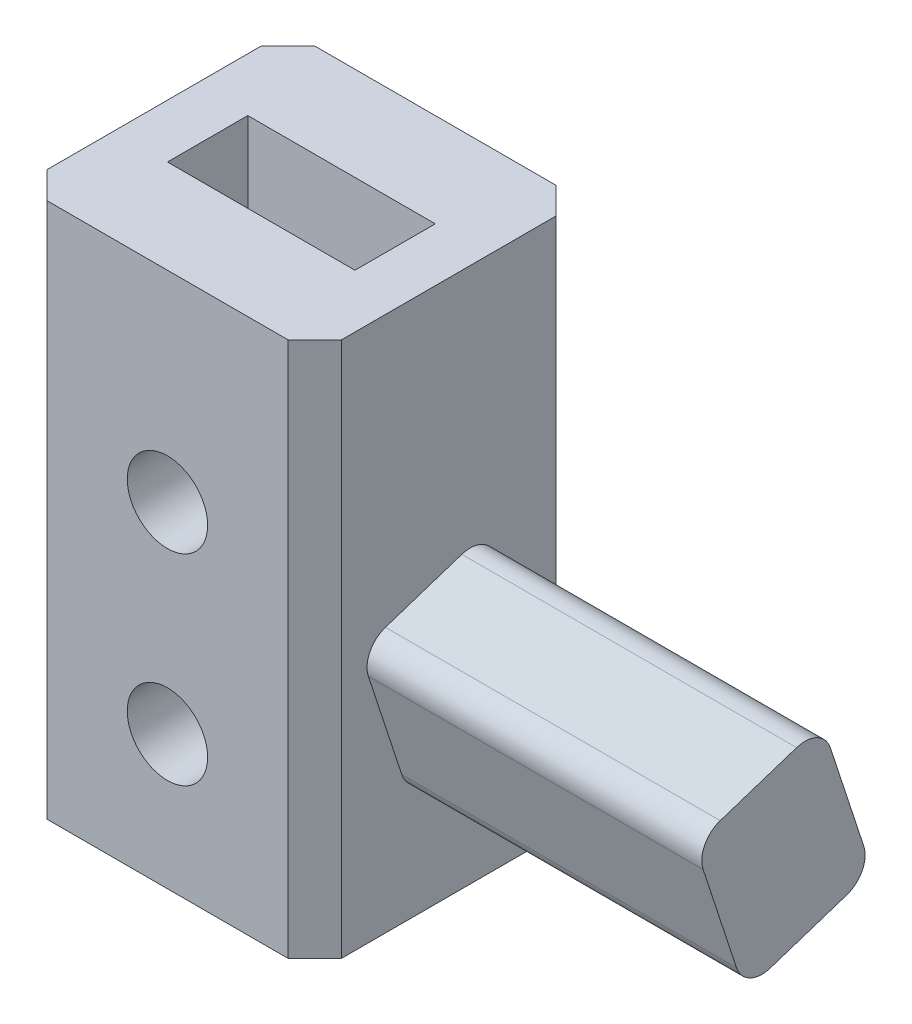
from build123d import *

# Parameters (mm, degrees)
CROQUIS1_W              = 14
CROQUIS1_H              = 6
SALIENTE_EXTRUIR1_DEPTH = 40
SALIENTE_EXTRUIR4_DEPTH = 25
CORTAR_EXTRUIR1_REACH   = 59.411
CROQUIS3_R              = 3


with BuildPart() as part:
    # Croquis1 → Saliente-Extruir1 (new body)
    with BuildSketch(Plane(origin=(0, 0, 0), x_dir=(1, 0, 0), z_dir=(0, 1, 0))):
        Polygon((-11, 8), (-9, 10), (9, 10), (11, 8), (11, -8), (9, -10), (-9, -10), (-11, -8), align=None)
        Rectangle(CROQUIS1_W, CROQUIS1_H, mode=Mode.SUBTRACT)
    extrude(amount=SALIENTE_EXTRUIR1_DEPTH)

    # Croquis2 → Saliente-Extruir4 (add)
    with BuildSketch(Plane(origin=(11, 0, 0), x_dir=(0, 0, -1), z_dir=(1, 0, 0))):
        with BuildLine():
            Line((-3.505117141, 9.641441068), (-5.99727833, 17.243357445))
            ThreePointArc((-5.99727833, 17.243357445), (-5.88119691, 18.769683379), (-4.719839533, 19.766876837))
            Line((-4.719839533, 19.766876837), (0.98159775, 21.635997729))
            ThreePointArc((0.98159775, 21.635997729), (2.507923683, 21.519916309), (3.505117141, 20.358558932))
            Line((3.505117141, 20.358558932), (5.99727833, 12.756642555))
            ThreePointArc((5.99727833, 12.756642555), (5.88119691, 11.230316621), (4.719839533, 10.233123163))
            Line((4.719839533, 10.233123163), (-0.98159775, 8.364002271))
            ThreePointArc((-0.98159775, 8.364002271), (-2.507923683, 8.480083691), (-3.505117141, 9.641441068))
        make_face()
    extrude(amount=SALIENTE_EXTRUIR4_DEPTH)

    # Croquis3 → Cortar-Extruir1 (cut, up to next)
    with BuildSketch(Plane.XY.offset(10), mode=Mode.PRIVATE) as cortar_extruir1_sk1:
        with Locations((0, 10)):
            Circle(CROQUIS3_R)
    cortar_extruir1_tool1 = extrude(cortar_extruir1_sk1.sketch, amount=-CORTAR_EXTRUIR1_REACH, mode=Mode.PRIVATE) & part.part
    # Croquis3 → Cortar-Extruir1 (cut, up to next)
    with BuildSketch(Plane.XY.offset(10), mode=Mode.PRIVATE) as cortar_extruir1_sk2:
        with Locations((0, 25)):
            Circle(CROQUIS3_R)
    cortar_extruir1_tool2 = extrude(cortar_extruir1_sk2.sketch, amount=-CORTAR_EXTRUIR1_REACH, mode=Mode.PRIVATE) & part.part
    add(cortar_extruir1_tool1.solids().sort_by_distance((0, 10, 10))[0], mode=Mode.SUBTRACT)
    add(cortar_extruir1_tool2.solids().sort_by_distance((0, 25, 10))[0], mode=Mode.SUBTRACT)


solid = part.part
